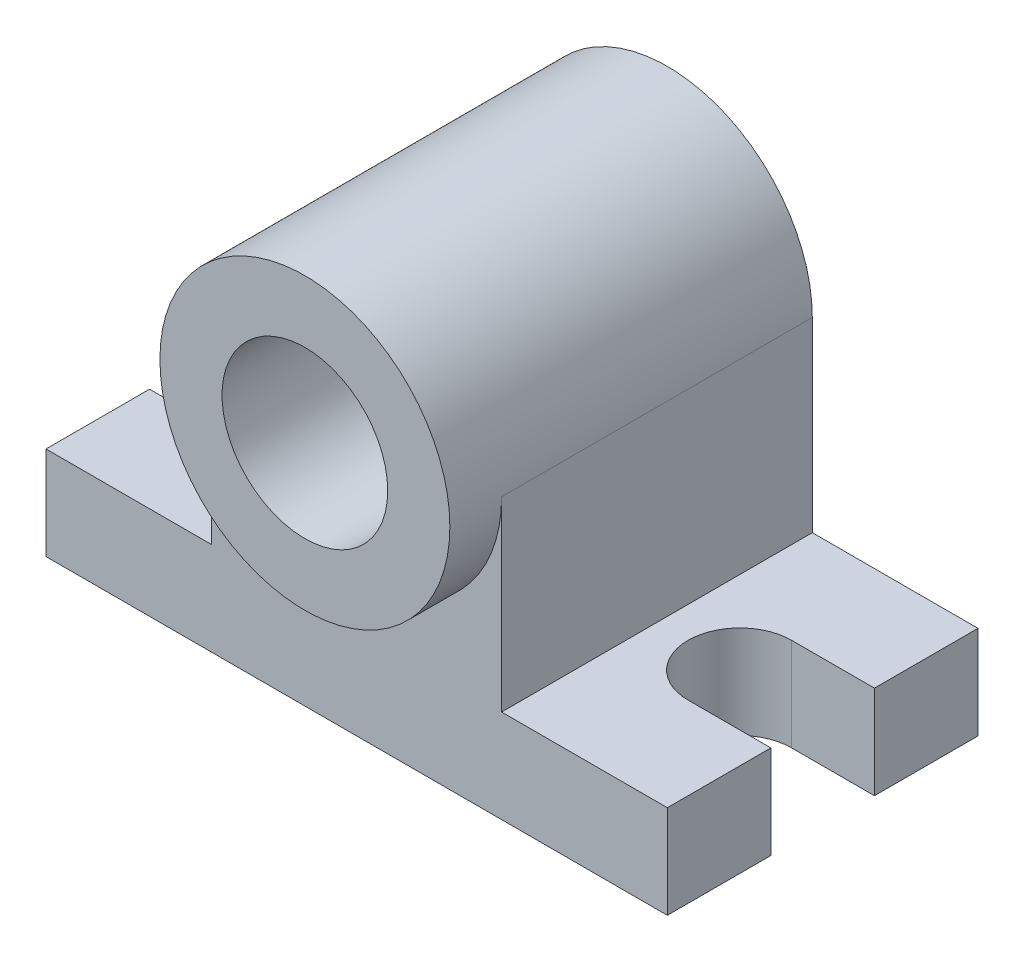
from build123d import *

# Parameters (mm, degrees)
SKETCH_1_R          = 8
EXTRUDE_1_DEPTH     = 30
EXTRUDE_START       = 5
SKETCH_1_3_R        = 14
SKETCH_1_3_R_2      = 8
EXTRUDE_2_DEPTH     = 5
CUT_EXTRUDE_1_DEPTH = 54.141321022


with BuildPart() as part:
    # 草图1 → 凸台-拉伸1 (new body)
    with BuildSketch(Plane.XY):
        with BuildLine():
            Line((30, -18), (14, -18))
            Line((14, -18), (14, 0))
            ThreePointArc((14, 0), (0, 14), (-14, 0))
            Line((-14, 0), (-14, -18))
            Line((-14, -18), (-30, -18))
            Line((-30, -18), (-30, -27))
            Line((-30, -27), (30, -27))
            Line((30, -27), (30, -18))
        make_face()
        Circle(SKETCH_1_R, mode=Mode.SUBTRACT)
    extrude(amount=-EXTRUDE_1_DEPTH)

    # 草图1<3> → 凸台-拉伸2 (add)
    with BuildSketch(Plane.XY.offset(EXTRUDE_START)):
        Circle(SKETCH_1_3_R)
        Circle(SKETCH_1_3_R_2, mode=Mode.SUBTRACT)
    extrude(amount=-EXTRUDE_2_DEPTH)

    # 草图2 → 切除-拉伸1 (cut, through all)
    with BuildSketch(Plane(origin=(0, -18, 0), x_dir=(1, 0, 0), z_dir=(0, 1, 0))):
        with BuildLine():
            Line((30, 10), (22, 10))
            ThreePointArc((22, 10), (17, 15), (22, 20))
            Line((22, 20), (30, 20))
            Line((30, 20), (30, 10))
        make_face()
        with BuildLine():
            Line((-30, 20), (-22, 20))
            ThreePointArc((-22, 20), (-17, 15), (-22, 10))
            Line((-22, 10), (-30, 10))
            Line((-30, 10), (-30, 20))
        make_face()
    extrude(amount=-CUT_EXTRUDE_1_DEPTH, mode=Mode.SUBTRACT)


solid = part.part
